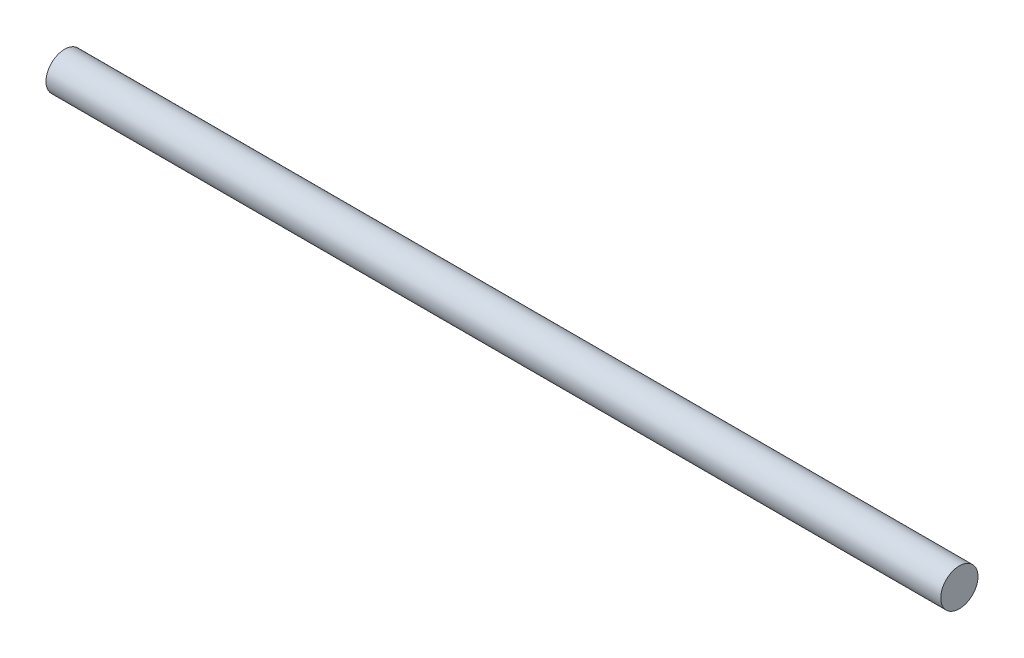
from build123d import *

# Parameters (mm, degrees)
SKETCH_1_R      = 2.5
EXTRUDE_1_DEPTH = 120


with BuildPart() as part:
    # 草图1 → 凸台-拉伸1 (new body)
    with BuildSketch(Plane(origin=(0, 0, 0), x_dir=(0, 0, -1), z_dir=(1, 0, 0))):
        Circle(SKETCH_1_R)
    extrude(amount=EXTRUDE_1_DEPTH)


solid = part.part
